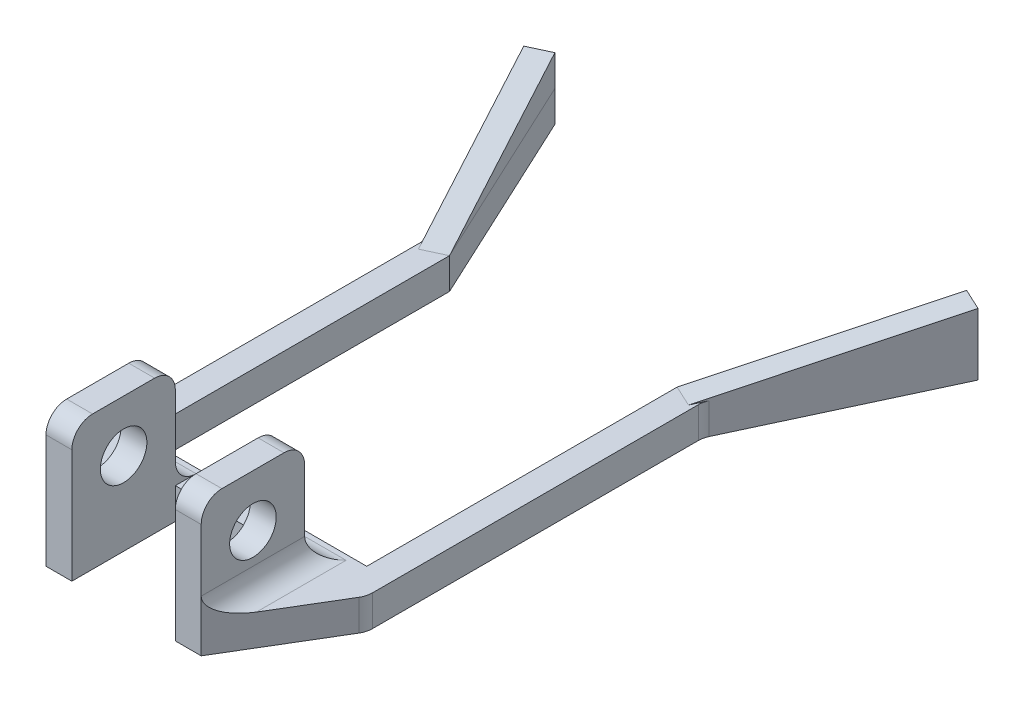
from build123d import *

# Parameters (mm, degrees)
BOSS_EXTRUDE1_DEPTH = 3
BOSS_EXTRUDE2_DEPTH = 2.265769468
SKETCH3_W           = 2.500000000000001
SKETCH3_H           = 10.000000000000002
BOSS_EXTRUDE3_DEPTH = 10
SKETCH4_R           = 2.25
CUT_EXTRUDE1_DEPTH  = 59.699680853056826
FILLET1_R           = 2


with BuildPart() as part:
    # Sketch1 → Boss-Extrude1 (new body)
    with BuildSketch(Plane(origin=(0, 0, 0), x_dir=(1, 0, 0), z_dir=(0, 1, 0))):
        Polygon((11, 0), (11.000000000000007, 30), (19.898880722705854, 49.083711294631705), (21.952365234814025, 48.126155740732976), (13.500000000000009, 30), (13.500000000000005, -2.5), (7.499999997441382, -12.5), (4.999999997441382, -12.5), (4.999999997441381, -2.5), (-4.999999997441381, -2.5), (-4.999999997441382, -12.5), (-7.499999997441382, -12.5), (-13.500000000000005, -2.5), (-13.500000000000009, 30), (-21.952365234814025, 48.126155740732976), (-19.898880722705854, 49.083711294631705), (-11.000000000000007, 30), (-11, 0), align=None)
    extrude(amount=BOSS_EXTRUDE1_DEPTH)


with BuildPart() as body_2:
    # Sketch2 → Boss-Extrude2 (new body)
    with BuildSketch(Plane(origin=(2.4553347935087504, 0, -1.1449414175475578), x_dir=(-0.42261826174070105, 0, -0.9063077870366492), z_dir=(0.9063077870366493, 0, -0.4226182617407011))):
        Polygon((31.8380344902472, 3), (52.89458014459895, 6), (52.89458014459895, 3), align=None)
    boss_extrude2 = extrude(amount=-BOSS_EXTRUDE2_DEPTH)


with BuildPart() as part_1:
    add(part.part)

    # Mirror4: Boss-Extrude2 across plane
    add(boss_extrude2.mirror(Plane(origin=(0, 0, 0), x_dir=(0, 0, 1), z_dir=(1, 0, 0))))

    # Sketch3 → Boss-Extrude3 (add)
    with BuildSketch(Plane(origin=(0, 3, 0), x_dir=(1, 0, 0), z_dir=(0, 1, 0))):
        with Locations((6.249999997441382, -7.500000000000001)):
            Rectangle(SKETCH3_W, SKETCH3_H)
        with Locations((-6.249999997441382, -7.500000000000001)):
            Rectangle(SKETCH3_W, SKETCH3_H)
    extrude(amount=BOSS_EXTRUDE3_DEPTH)

    # Sketch4 → Cut-Extrude1 (cut, through all)
    with BuildSketch(Plane(origin=(7.499999997441382, 0, 0), x_dir=(0, 0, -1), z_dir=(1, 0, 0))):
        with Locations((-7.500000000000001, 8)):
            Circle(SKETCH4_R)
    extrude(amount=-CUT_EXTRUDE1_DEPTH, mode=Mode.SUBTRACT)

    # Fillet1
    fillet1_edges = [part_1.edges().sort_by_distance(p)[0] for p in [
        (13.500000000000009, 1.5, -30),
        (13.500000000000005, 1.5, 2.5),
        (-13.500000000000005, 1.5, 2.5),
        (-13.500000000000009, 1.5, -30),
        (7.499999997441382, 3, 7.5),
        (6.249999997441382, 3, 2.5),
        (6.249999997441382, 13, 2.5),
        (6.249999997441382, 13, 12.5),
        (-7.499999997441382, 3, 7.5),
        (-6.249999997441382, 3, 2.5),
        (-6.249999997441382, 13, 12.5),
        (-6.249999997441382, 13, 2.5),
    ]]
    fillet(fillet1_edges, radius=FILLET1_R)


solid = Compound([body_2.part, part_1.part])
